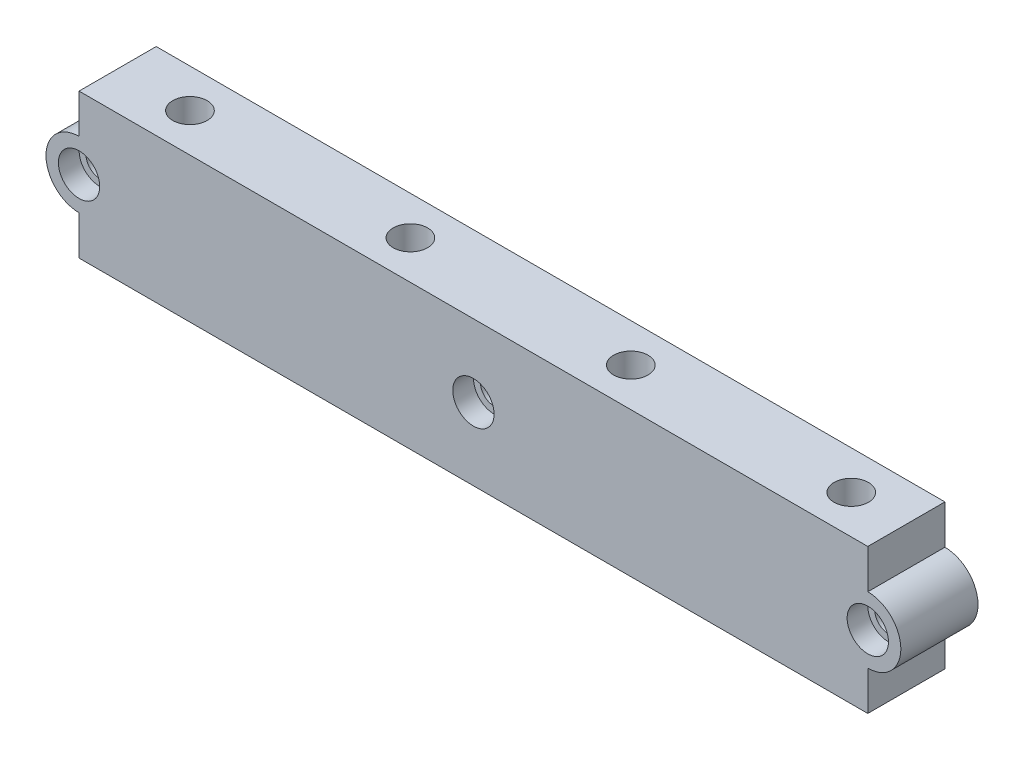
from build123d import *

# Parameters (mm, degrees)
SKETCH1_R           = 3.175
BOSS_EXTRUDE1_DEPTH = 17.78
SKETCH2_R           = 3.96875
CUT_EXTRUDE1_DEPTH  = 33.3375
SKETCH3_R           = 4.7625
CUT_EXTRUDE2_DEPTH  = 4.7752


with BuildPart() as part:
    # Sketch1 → Boss-Extrude1 (new body)
    with BuildSketch(Plane.XY):
        with BuildLine():
            Line((0, 16.66875), (0, 7.62))
            ThreePointArc((0, 7.62), (7.62, 0), (0, -7.62))
            Line((0, -7.62), (0, -16.66875))
            Line((0, -16.66875), (-181.76875, -16.66875))
            Line((-181.76875, -16.66875), (-181.76875, -7.62))
            ThreePointArc((-181.76875, -7.62), (-189.38875, 0), (-181.76875, 7.62))
            Line((-181.76875, 7.62), (-181.76875, 16.66875))
            Line((-181.76875, 16.66875), (0, 16.66875))
        make_face()
        Circle(SKETCH1_R, mode=Mode.SUBTRACT)
        with Locations((-181.76875, 0)):
            Circle(SKETCH1_R, mode=Mode.SUBTRACT)
        with Locations((-90.884375, 0)):
            Circle(SKETCH1_R, mode=Mode.SUBTRACT)
    extrude(amount=-BOSS_EXTRUDE1_DEPTH)

    # Sketch2 → Cut-Extrude1 (cut)
    with BuildSketch(Plane(origin=(0, 16.66875, 0), x_dir=(1, 0, 0), z_dir=(0, 1, 0))):
        with Locations(Location((-12.7, 8.89, 0), (0, 0, 270))):
            Circle(SKETCH2_R)
        with Locations(Location((-63.5, 8.89, 0), (0, 0, 270))):
            Circle(SKETCH2_R)
        with Locations(Location((-114.3, 8.89, 0), (0, 0, 270))):
            Circle(SKETCH2_R)
        with Locations(Location((-165.1, 8.89, 0), (0, 0, 270))):
            Circle(SKETCH2_R)
    extrude(amount=-CUT_EXTRUDE1_DEPTH, mode=Mode.SUBTRACT)

    # Sketch3 → Cut-Extrude2 (cut)
    with BuildSketch(Plane.XY):
        Circle(SKETCH3_R)
        with Locations((-90.884375, 0)):
            Circle(SKETCH3_R)
        with Locations((-181.76875, 0)):
            Circle(SKETCH3_R)
    extrude(amount=-CUT_EXTRUDE2_DEPTH, mode=Mode.SUBTRACT)


solid = part.part
